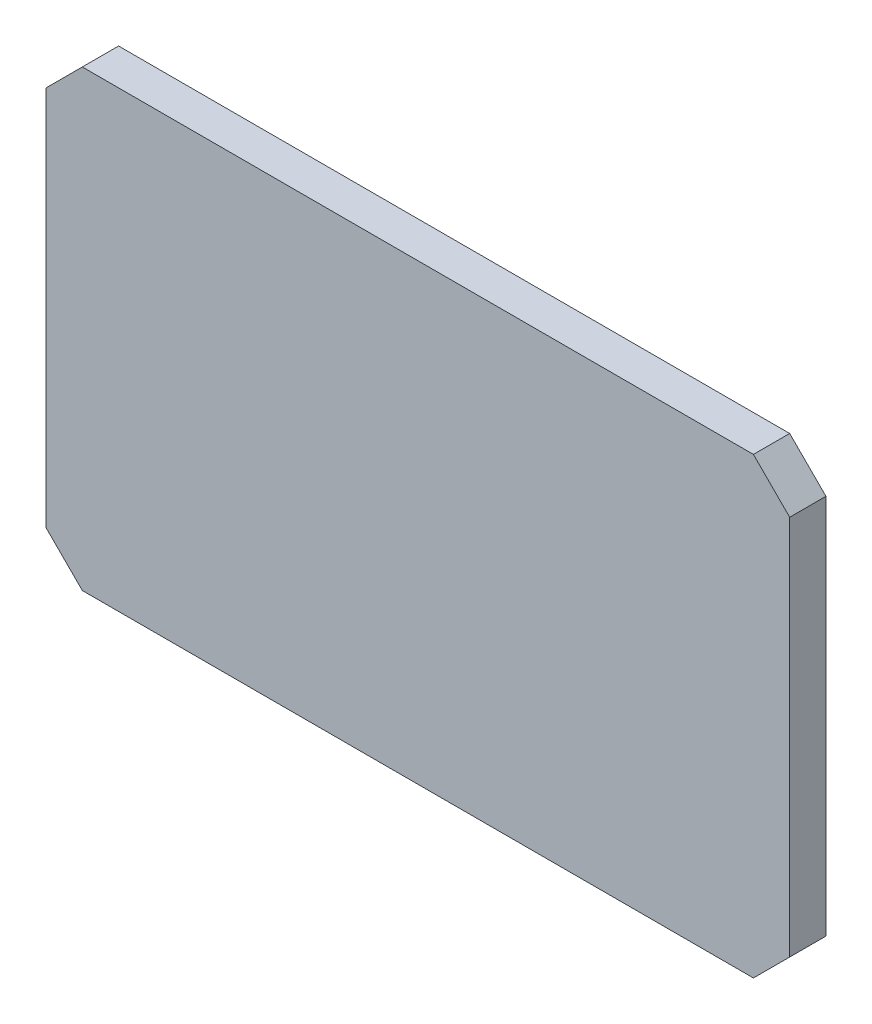
from build123d import *

# Parameters (mm, degrees)
BOSS_EXTRUDE1_DEPTH = 2
CUT_EXTRUDE2_DEPTH  = 1


with BuildPart() as part:
    # Sketch3 → Boss-Extrude1 (new body)
    with BuildSketch(Plane.XY):
        Polygon((146.625606574, 159.719339874), (183.625606574, 159.719339874), (185.625606574, 157.719339874), (185.625606574, 136.719339874), (183.625606574, 134.719339874), (146.625606574, 134.719339874), (144.625606574, 136.719339874), (144.625606574, 157.719339874), align=None)
    extrude(amount=BOSS_EXTRUDE1_DEPTH)

    # Sketch4 → Cut-Extrude2 (cut)
    with BuildSketch(Plane.XY):
        with BuildLine():
            Line((183.985590549, 149.719355145), (183.985590549, 144.719355145))
            ThreePointArc((183.985590549, 144.719355145), (182.485590549, 143.219355145), (180.985590549, 144.719355145))
            Line((180.985590549, 144.719355145), (180.985590549, 146.219355145))
            Line((180.985590549, 146.219355145), (172.842061199, 146.219355145))
            Line((172.842061199, 146.219355145), (168.466892344, 142.221525657))
            ThreePointArc((168.466892344, 142.221525657), (164.985590549, 140.717307295), (161.504288754, 142.221525657))
            Line((161.504288754, 142.221525657), (156.8366409, 146.486989717))
            ThreePointArc((156.8366409, 146.486989717), (156.485875357, 147.242486304), (156.873407646, 147.979799185))
            Line((156.873407646, 147.979799185), (161.520046065, 152.231799364))
            ThreePointArc((161.520046065, 152.231799364), (164.985590549, 153.719355145), (168.451135032, 152.231799364))
            Line((168.451135032, 152.231799364), (172.836292086, 148.219355145))
            Line((172.836292086, 148.219355145), (180.985590549, 148.219355145))
            Line((180.985590549, 148.219355145), (180.985590549, 149.719355145))
            ThreePointArc((180.985590549, 149.719355145), (182.485590549, 151.219355145), (183.985590549, 149.719355145))
        make_face()
    extrude(amount=CUT_EXTRUDE2_DEPTH, mode=Mode.SUBTRACT)


solid = part.part
